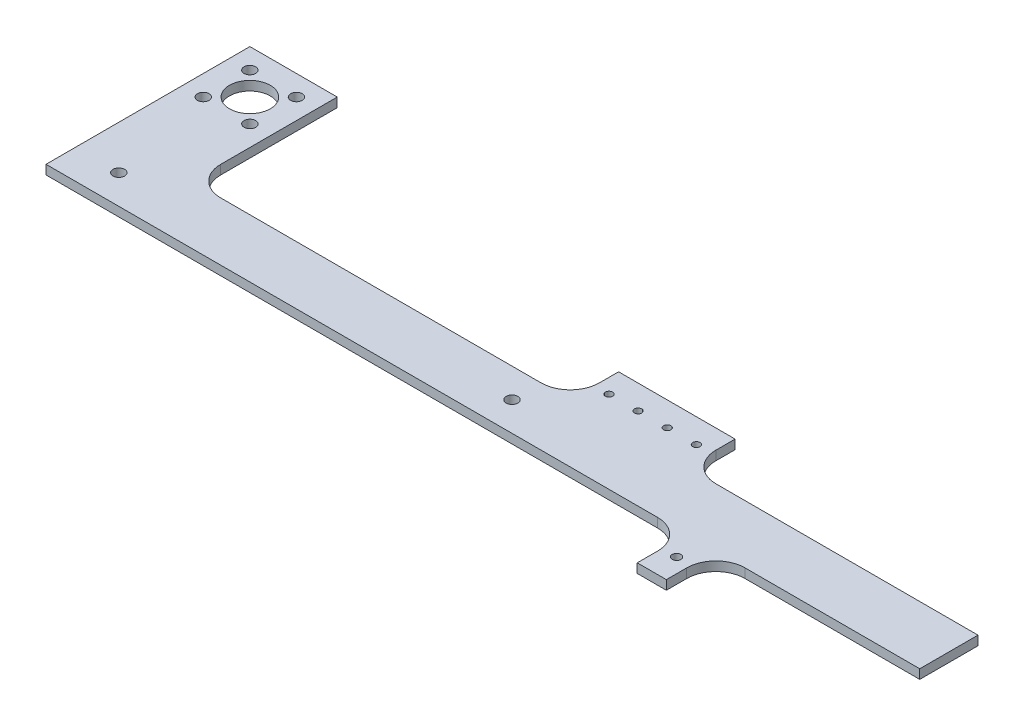
from build123d import *

# Parameters (mm, degrees)
SKETCH1_R           = 1.5
SKETCH1_R_2         = 2
SKETCH1_R_3         = 1.25
BOSS_EXTRUDE1_DEPTH = 3.175
FILLET1_R           = 10
SKETCH2_W           = 70
SKETCH2_H           = 20
BOSS_EXTRUDE2_DEPTH = 3.175
FILLET2_R           = 10


with BuildPart() as part:
    # Sketch1 → Boss-Extrude1 (new body)
    with BuildSketch(Plane(origin=(0, 0, 0), x_dir=(1, 0, 0), z_dir=(0, 1, 0))):
        Polygon((220, -17), (225, -17), (230, -17), (230, 10), (230, 20), (200, 20), (200, 36.6), (195, 36.6), (160, 36.6), (160, 20), (30, 20), (30, 70), (15, 70), (0, 70), (0, 0), (220, 0), align=None)
        with Locations((225, -8.5)):
            Circle(SKETCH1_R, mode=Mode.SUBTRACT)
        with Locations((15, 10)):
            Circle(SKETCH1_R_2, mode=Mode.SUBTRACT)
        with BuildLine():
            ThreePointArc((148, 10), (150, 12), (152, 10))
            ThreePointArc((152, 10), (150, 8), (148, 10))
        make_face(mode=Mode.SUBTRACT)
        with Locations((7, 47)):
            Circle(SKETCH1_R_2, mode=Mode.SUBTRACT)
        with Locations((23, 47)):
            Circle(SKETCH1_R_2, mode=Mode.SUBTRACT)
        with BuildLine():
            ThreePointArc((10.050252532, 59.949747468), (12.321215973, 61.467156728), (15, 62))
            ThreePointArc((15, 62), (17.678784027, 48.532843272), (10.050252532, 59.949747468))
        make_face(mode=Mode.SUBTRACT)
        with Locations((7, 63)):
            Circle(SKETCH1_R_2, mode=Mode.SUBTRACT)
        with Locations((23, 63)):
            Circle(SKETCH1_R_2, mode=Mode.SUBTRACT)
        with Locations((185, 28.3)):
            Circle(SKETCH1_R_3, mode=Mode.SUBTRACT)
        with Locations((165, 28.3)):
            Circle(SKETCH1_R_3, mode=Mode.SUBTRACT)
        with Locations((175, 28.3)):
            Circle(SKETCH1_R_3, mode=Mode.SUBTRACT)
        with Locations((195, 28.3)):
            Circle(SKETCH1_R_3, mode=Mode.SUBTRACT)
    extrude(amount=BOSS_EXTRUDE1_DEPTH)

    # Fillet1
    fillet1_edges = [part.edges().sort_by_distance(p)[0] for p in [
        (220, 1.5875, 0),
        (200, 1.5875, -20),
        (160, 1.5875, -20),
        (30, 1.5875, -20),
    ]]
    fillet(fillet1_edges, radius=FILLET1_R)

    # Sketch2 → Boss-Extrude2 (add)
    with BuildSketch(Plane(origin=(0, 0, 0), x_dir=(-1, 0, 0), z_dir=(0, -1, 0))):
        with Locations((-265, 10)):
            Rectangle(SKETCH2_W, SKETCH2_H)
    extrude(amount=-BOSS_EXTRUDE2_DEPTH)

    # Fillet2
    fillet2_edges = [part.edges().sort_by_distance(p)[0] for p in [
        (230, 1.5875, 0),
    ]]
    fillet(fillet2_edges, radius=FILLET2_R)


solid = part.part
